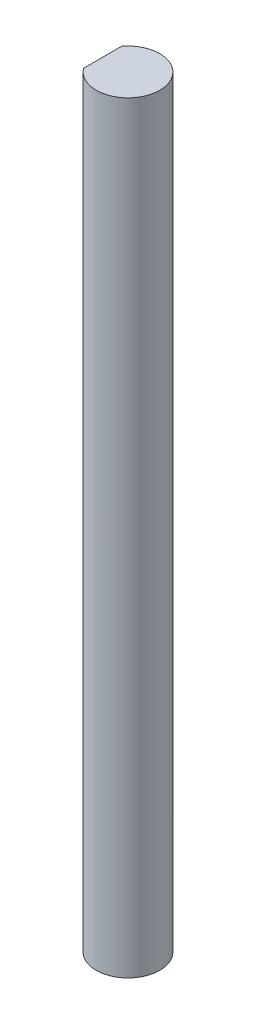
from build123d import *

# Parameters (mm, degrees)
ESBO_O1_R                = 2.5
RESSALTO_EXTRUS_O1_DEPTH = 30
CORTE_EXTRUS_O1_DEPTH    = 15


with BuildPart() as part:
    # Esboço1 → Ressalto-extrusão1 (new, symmetric)
    with BuildSketch(Plane(origin=(0, 0, 0), x_dir=(1, 0, 0), z_dir=(0, 1, 0))):
        with Locations(Location((0, 0, 0), (0, 0, 270))):
            Circle(ESBO_O1_R)
    extrude(amount=RESSALTO_EXTRUS_O1_DEPTH, both=True)

    # Esboço2 → Corte-extrusão1 (cut)
    with BuildSketch(Plane(origin=(0, 30, 0), x_dir=(1, 0, 0), z_dir=(0, 1, 0))):
        with BuildLine():
            Line((-2, -1.5), (-2, 1.5))
            ThreePointArc((-2, 1.5), (-2.5, 0), (-2, -1.5))
        make_face()
    extrude(amount=-CORTE_EXTRUS_O1_DEPTH, mode=Mode.SUBTRACT)


solid = part.part
